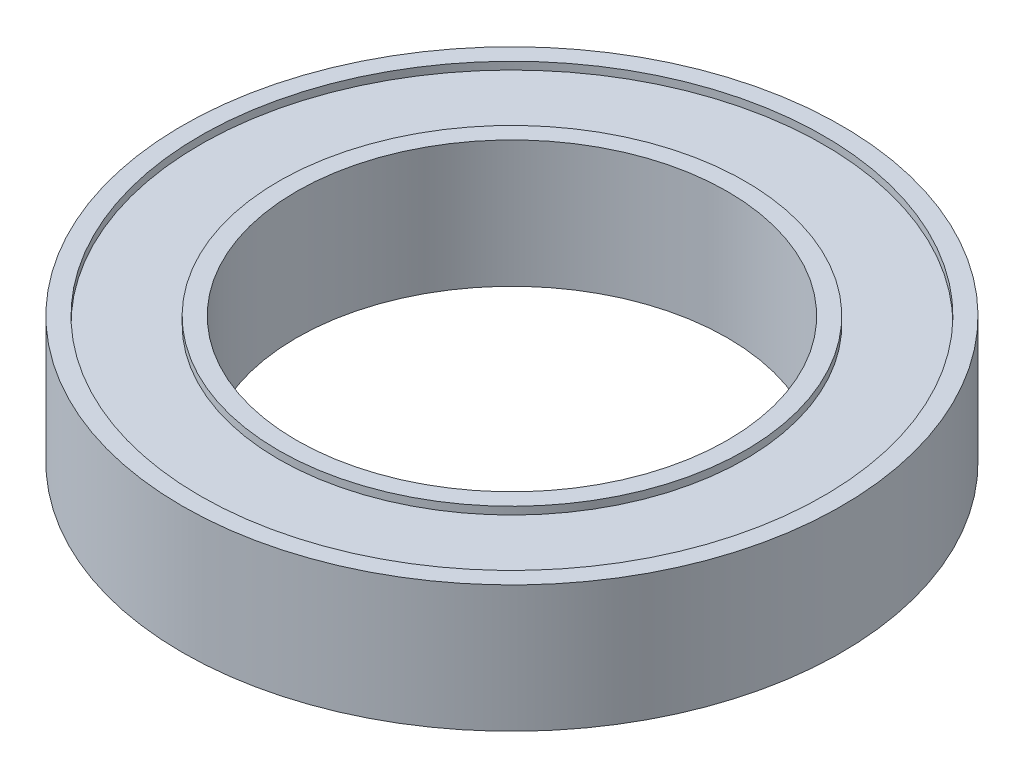
from build123d import *

# Parameters (mm, degrees)
SKETCH_1_R          = 13
SKETCH_1_R_2        = 8.5
EXTRUDE_1_DEPTH     = 5
SKETCH_2_R          = 12.3
SKETCH_2_R_2        = 9.2
CUT_EXTRUDE_1_DEPTH = 0.3


with BuildPart() as part:
    # 草图1 → 凸台-拉伸1 (new body)
    with BuildSketch(Plane(origin=(0, 0, 0), x_dir=(1, 0, 0), z_dir=(0, 1, 0))):
        with Locations(Location((0, 0, 0), (0, 0, 270))):
            Circle(SKETCH_1_R)
        with Locations(Location((0, 0, 0), (0, 0, 270))):
            Circle(SKETCH_1_R_2, mode=Mode.SUBTRACT)
    extrude(amount=EXTRUDE_1_DEPTH)

    # 草图2 → 切除-拉伸1 (cut)
    with BuildSketch(Plane(origin=(0, 5, 0), x_dir=(1, 0, 0), z_dir=(0, 1, 0))):
        with Locations(Location((0, 0, 0), (0, 0, 270))):
            Circle(SKETCH_2_R)
        with Locations(Location((0, 0, 0), (0, 0, 270))):
            Circle(SKETCH_2_R_2, mode=Mode.SUBTRACT)
    cut_extrude_1 = extrude(amount=-CUT_EXTRUDE_1_DEPTH, mode=Mode.SUBTRACT)

    # 镜向1: 切除-拉伸1 across plane
    add(cut_extrude_1.mirror(Plane.ZX.offset(2.5)), mode=Mode.SUBTRACT)


solid = part.part
